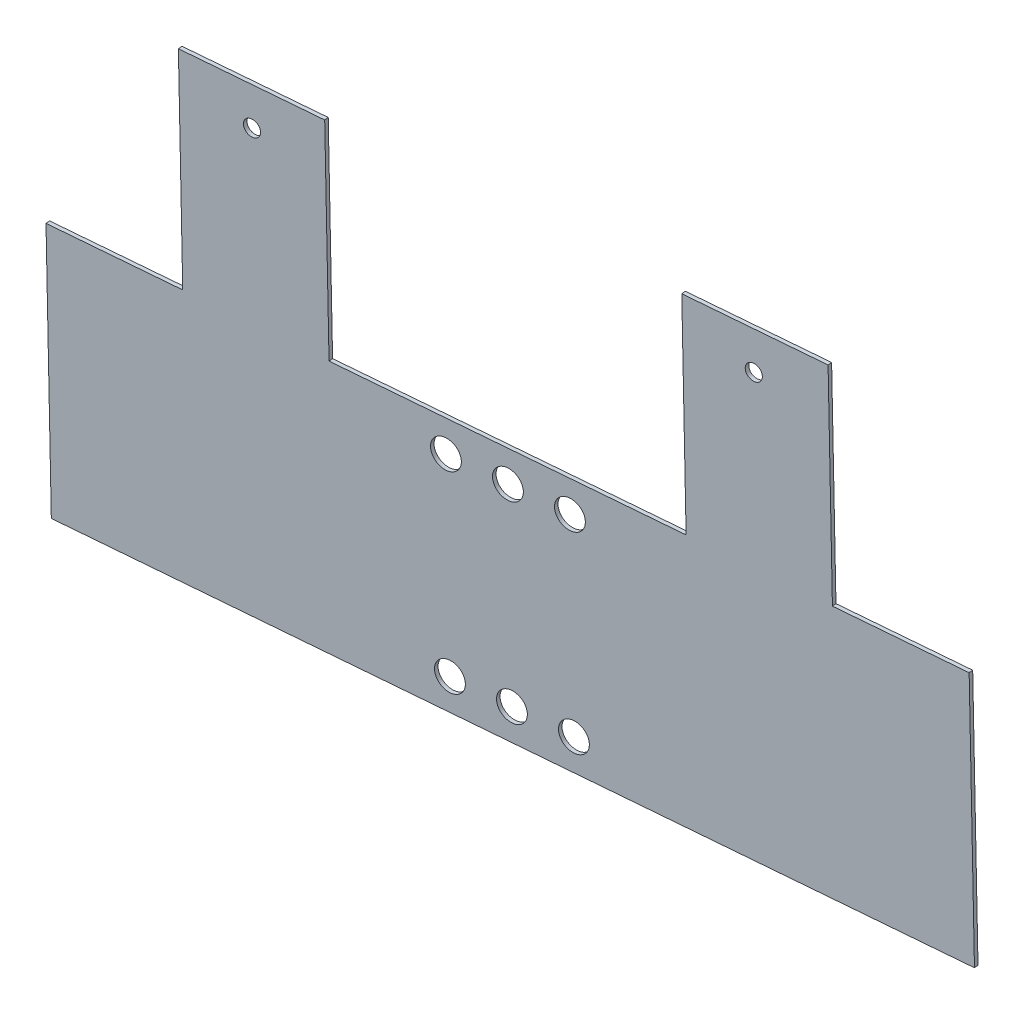
from build123d import *

# Parameters (mm, degrees)
BOSS_EXTRUDE1_DEPTH = 0.6096
SKETCH5_R           = 2.25
CUT_EXTRUDE2_DEPTH  = 0.6096
SKETCH6_R           = 1.25
CUT_EXTRUDE5_DEPTH  = 0.6096
SKETCH7_R           = 1.25
CUT_EXTRUDE6_DEPTH  = 0.6096


with BuildPart() as part:
    # Sketch1 → Boss-Extrude1 (new body)
    with BuildSketch(Plane(origin=(16.997226787, -4.149929847, 204.631375634), x_dir=(0.9965694099183702, 0.001959509651517015, -0.0827379691367708), z_dir=(-0.08276069418699705, 0.02020630066742911, -0.9963645783100802))):
        Polygon((-405.631572024, 283.216979703), (-385.692572024, 283.216979703), (-385.692572024, 323.856979703), (-405.014358213, 323.856979703), (-432.414358217, 323.856979703), (-445.097076418, 323.856979703), (-465.359895626, 323.856979703), (-479.498480719, 323.856979703), (-500.373572024, 323.856979703), (-520.312572024, 323.856979703), (-520.312572024, 283.216979703), (-500.373572024, 283.216979703), (-500.373572024, 250.003685703), (-479.037572024, 250.003685703), (-479.037572024, 283.216979703), (-426.967572024, 283.216979703), (-426.967572024, 250.003685703), (-405.631572024, 250.003685703), align=None)
    extrude(amount=BOSS_EXTRUDE1_DEPTH)

    # Sketch5 → Cut-Extrude2 (cut)
    with BuildSketch(Plane(origin=(16.946775868, -4.137612086, 204.023991787), x_dir=(-0.9965694494101686, -0.0016780440853138524, 0.08274368054637986), z_dir=(-0.08276069418699686, 0.020206300667429084, -0.9963645783100801))):
        with Locations(Location((461.99617795, -318.987055127, 0), (0, 0, 0.096164523))):
            Circle(SKETCH5_R)
        with Locations(Location((452.956635294, -318.984510283, 0), (0, 0, 0.096164523))):
            Circle(SKETCH5_R)
        with Locations(Location((443.917092638, -318.981965439, 0), (0, 0, 0.096164523))):
            Circle(SKETCH5_R)
    cut_extrude2 = extrude(amount=-CUT_EXTRUDE2_DEPTH, mode=Mode.SUBTRACT)

    # Mirror1: Cut-Extrude2 across plane
    add(cut_extrude2.mirror(Plane(origin=(0.085159645, -303.474424262, -6.16154314), x_dir=(5.696257509048786e-06, -0.02029915071256955, 0.9997939509958544), z_dir=(0.00028055772663953236, -0.9997939116314238, -0.02029915151179877))), mode=Mode.SUBTRACT)

    # Sketch6 → Cut-Extrude5 (cut)
    with BuildSketch(Plane(origin=(16.946775868, -4.137612086, 204.023991787), x_dir=(-0.9965694494101686, -0.0016780440853136297, 0.08274368054637984), z_dir=(-0.08276069418699684, 0.0202063006674291, -0.9963645783100802))):
        with Locations(Location((416.50680125, -256.173836565, 0), (0, 0, 0.096164523))):
            Circle(SKETCH6_R)
    extrude(amount=-CUT_EXTRUDE5_DEPTH, mode=Mode.SUBTRACT)

    # Sketch7 → Cut-Extrude6 (cut)
    with BuildSketch(Plane(origin=(16.946775868, -4.137612086, 204.023991787), x_dir=(-0.9965694494101686, -0.0016780440853141855, 0.08274368054637984), z_dir=(-0.08276069418699686, 0.020206300667429067, -0.9963645783100802))):
        with Locations(Location((489.681466673, -256.194436956, 0), (0, 0, 0.096164523))):
            Circle(SKETCH7_R)
    extrude(amount=-CUT_EXTRUDE6_DEPTH, mode=Mode.SUBTRACT)


solid = part.part
